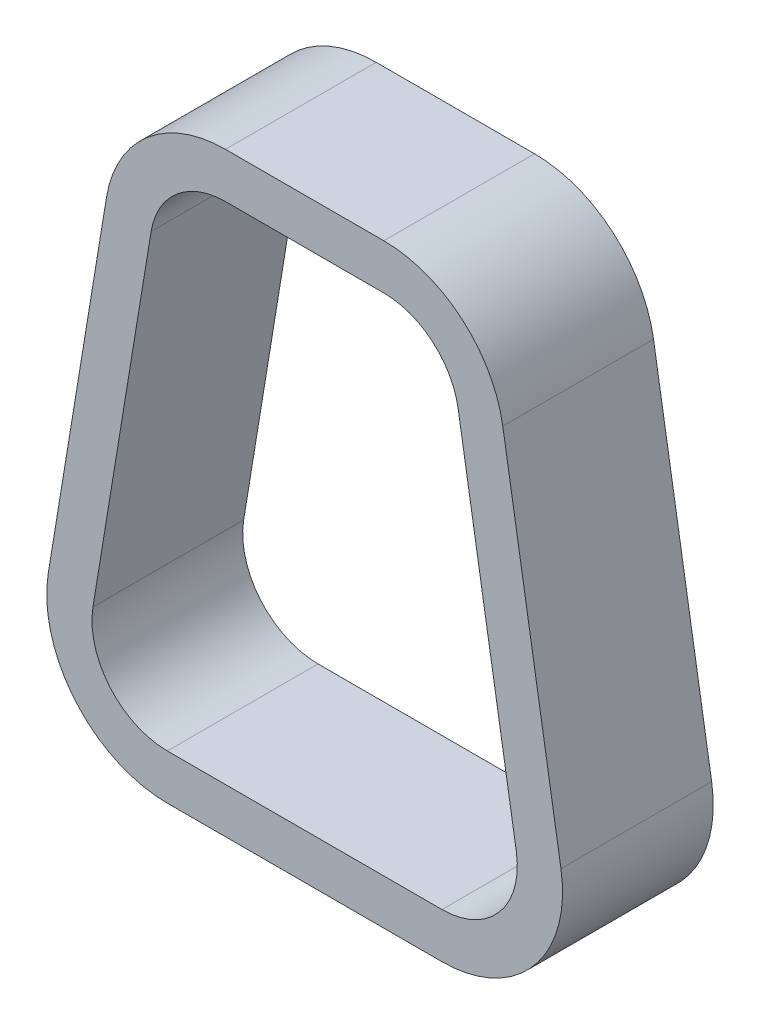
from build123d import *

# Parameters (mm, degrees)
BOSS_EXTRU_2_DEPTH = 10
CONG_2_R           = 5
COQUE3_T           = 3


with BuildPart() as part:
    # Esquisse1 → Boss.-Extru.2 (new body)
    with BuildSketch(Plane.XY):
        Polygon((-15, 0), (15, 0), (9.5, 33.5), (-9.5, 33.5), align=None)
    extrude(amount=BOSS_EXTRU_2_DEPTH)

    # Congé2
    cong_2_edges = [part.edges().sort_by_distance(p)[0] for p in [
        (15, 0, 5),
        (-15, 0, 5),
        (-9.5, 33.5, 5),
        (9.5, 33.5, 5),
    ]]
    fillet(cong_2_edges, radius=CONG_2_R)

    # Coque3
    coque3_openings = [part.faces().sort_by_distance(p)[0] for p in [
        (0, 15.617025891, 0),
        (0, 15.617025891, 10),
    ]]
    offset(amount=COQUE3_T, openings=coque3_openings, kind=Kind.INTERSECTION)


solid = part.part
